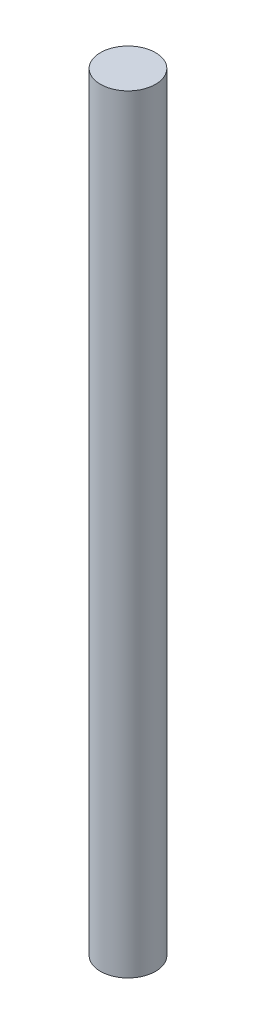
from build123d import *

# Parameters (mm, degrees)
SKETCH1_R           = 2.5
BOSS_EXTRUDE1_DEPTH = 69.85


with BuildPart() as part:
    # Sketch1 → Boss-Extrude1 (new body)
    with BuildSketch(Plane(origin=(0, 0, 0), x_dir=(1, 0, 0), z_dir=(0, 1, 0))):
        with Locations(Location((0, 0, 0), (0, 0, 270))):
            Circle(SKETCH1_R)
    extrude(amount=BOSS_EXTRUDE1_DEPTH)


solid = part.part
